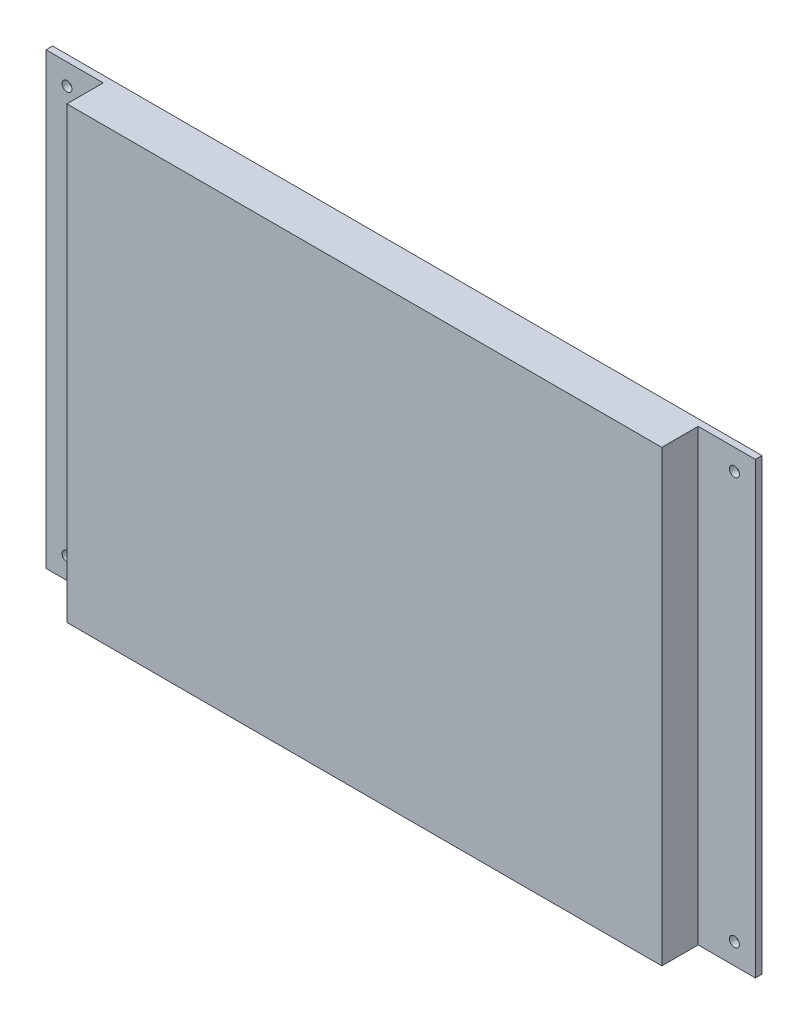
from build123d import *

# Parameters (mm, degrees)
SKETCH_1_W      = 214.63
SKETCH_1_H      = 135.89
SKETCH_1_R      = 1.5
EXTRUDE_1_DEPTH = 2
SKETCH_2_W      = 180
SKETCH_2_H      = 135.89
EXTRUDE_2_DEPTH = 11


with BuildPart() as part:
    # 스케치1 → 보스-돌출1 (new body)
    with BuildSketch(Plane.XY):
        Rectangle(SKETCH_1_W, SKETCH_1_H)
        with Locations((100.965, 61.595)):
            Circle(SKETCH_1_R, mode=Mode.SUBTRACT)
        with Locations((100.965, -61.595)):
            Circle(SKETCH_1_R, mode=Mode.SUBTRACT)
        with Locations(Location((-100.965, -61.595, 0), (0, 0, 180))):
            Circle(SKETCH_1_R, mode=Mode.SUBTRACT)
        with Locations(Location((-100.965, 61.595, 0), (0, 0, 180))):
            Circle(SKETCH_1_R, mode=Mode.SUBTRACT)
    extrude(amount=EXTRUDE_1_DEPTH)

    # 스케치2 → 보스-돌출2 (add)
    with BuildSketch(Plane.XY.offset(2)):
        Rectangle(SKETCH_2_W, SKETCH_2_H)
    extrude(amount=EXTRUDE_2_DEPTH)


solid = part.part
